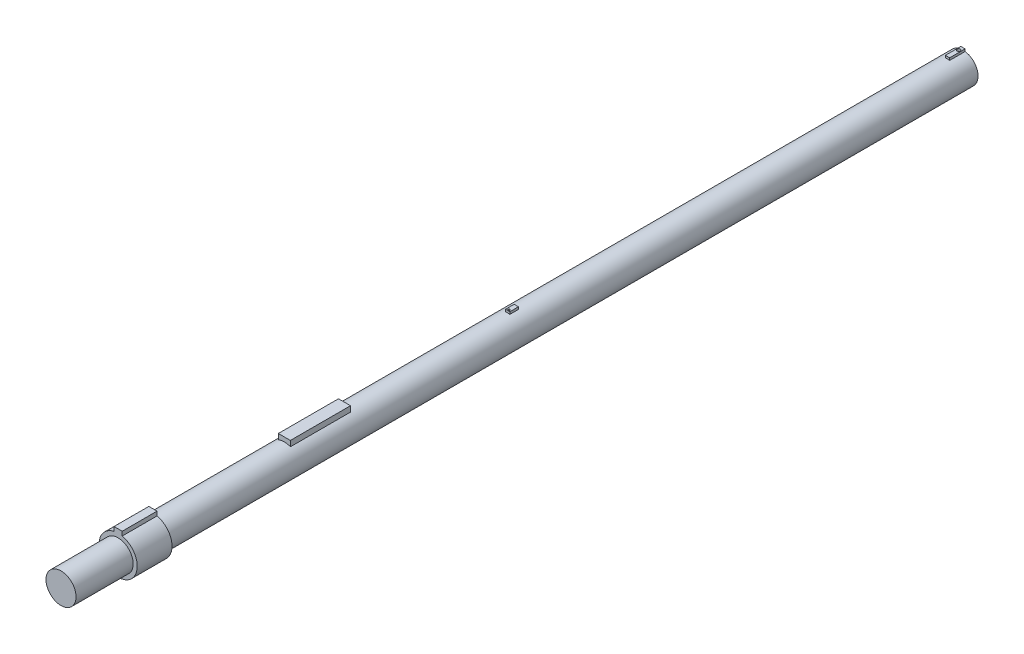
from build123d import *

# Parameters (mm, degrees)
SKETCH1_R                = 17.5
BOSS_EXTRUDE1_DEPTH      = 1050
BOSS_EXTRUDE2_DEPTH      = 5
BOSS_EXTRUDE2_DEPTH_BACK = 5
SKETCH2_W                = 5
SKETCH2_H                = 5
BOSS_EXTRUDE3_START      = -40.50047623
SKETCH5_R                = 17.5
SKETCH5_R_2              = 11.1125
BOSS_EXTRUDE3_DEPTH      = 40.50047623
SKETCH7_R                = 22.225
BOSS_EXTRUDE4_DEPTH      = 40.50047623
SKETCH11_W               = 9.53
SKETCH11_H               = 8.74
BOSS_EXTRUDE5_DEPTH      = 40.50047623
SKETCH12_W               = 5
SKETCH12_H               = 5
BOSS_EXTRUDE6_DEPTH      = 18
SKETCH13_R               = 2
CUT_EXTRUDE1_DEPTH       = 10
SKETCH15_R               = 1
CUT_EXTRUDE3_DEPTH       = 10
SKETCH16_W               = 14
SKETCH16_H               = 10
BOSS_EXTRUDE7_DEPTH      = 70


with BuildPart() as part:
    # Sketch1 → Boss-Extrude1 (new body)
    with BuildSketch(Plane.XY):
        Circle(SKETCH1_R)
    extrude(amount=BOSS_EXTRUDE1_DEPTH)

    # Sketch2 → Boss-Extrude2 (add, two sides: drawn at the far end of the back side and taken through both)
    with BuildSketch(Plane.XY.offset(525).offset(-BOSS_EXTRUDE2_DEPTH_BACK)):
        with Locations((0, 17.5)):
            Rectangle(SKETCH2_W, SKETCH2_H)
    extrude(amount=BOSS_EXTRUDE2_DEPTH + BOSS_EXTRUDE2_DEPTH_BACK)

    # Sketch5 → Boss-Extrude3 (add)
    with BuildSketch(Plane.XY.offset(1050).offset(BOSS_EXTRUDE3_START)):
        Circle(SKETCH5_R)
        Circle(SKETCH5_R_2, mode=Mode.SUBTRACT)
    extrude(amount=BOSS_EXTRUDE3_DEPTH)

    # Sketch7 → Boss-Extrude4 (add)
    with BuildSketch(Plane.XY.offset(943)):
        Circle(SKETCH7_R)
    extrude(amount=BOSS_EXTRUDE4_DEPTH)

    # Sketch11 → Boss-Extrude5 (add)
    with BuildSketch(Plane.XY.offset(983.50047623)):
        with Locations((0, 22.225)):
            Rectangle(SKETCH11_W, SKETCH11_H)
    extrude(amount=-BOSS_EXTRUDE5_DEPTH)

    # Sketch12 → Boss-Extrude6 (add)
    with BuildSketch(Plane(origin=(0, 0, 0), x_dir=(-1, 0, 0), z_dir=(0, 0, -1))):
        with Locations((0, 17.5)):
            Rectangle(SKETCH12_W, SKETCH12_H)
    extrude(amount=-BOSS_EXTRUDE6_DEPTH)

    # Sketch13 → Cut-Extrude1 (cut)
    with BuildSketch(Plane(origin=(0, 20, 0), x_dir=(1, 0, 0), z_dir=(0, 1, 0))):
        with Locations(Location((0, -5, 0), (0, 0, 270))):
            Circle(SKETCH13_R)
    extrude(amount=-CUT_EXTRUDE1_DEPTH, mode=Mode.SUBTRACT)

    # Sketch15 → Cut-Extrude3 (cut)
    with BuildSketch(Plane(origin=(0, 20, 0), x_dir=(1, 0, 0), z_dir=(0, 1, 0))):
        with Locations(Location((0, -528.5, 0), (0, 0, 270))):
            Circle(SKETCH15_R)
    extrude(amount=-CUT_EXTRUDE3_DEPTH, mode=Mode.SUBTRACT)

    # Sketch16 → Boss-Extrude7 (add)
    with BuildSketch(Plane.XY.offset(790)):
        with Locations((0, 17.5)):
            Rectangle(SKETCH16_W, SKETCH16_H)
    extrude(amount=-BOSS_EXTRUDE7_DEPTH)


solid = part.part
